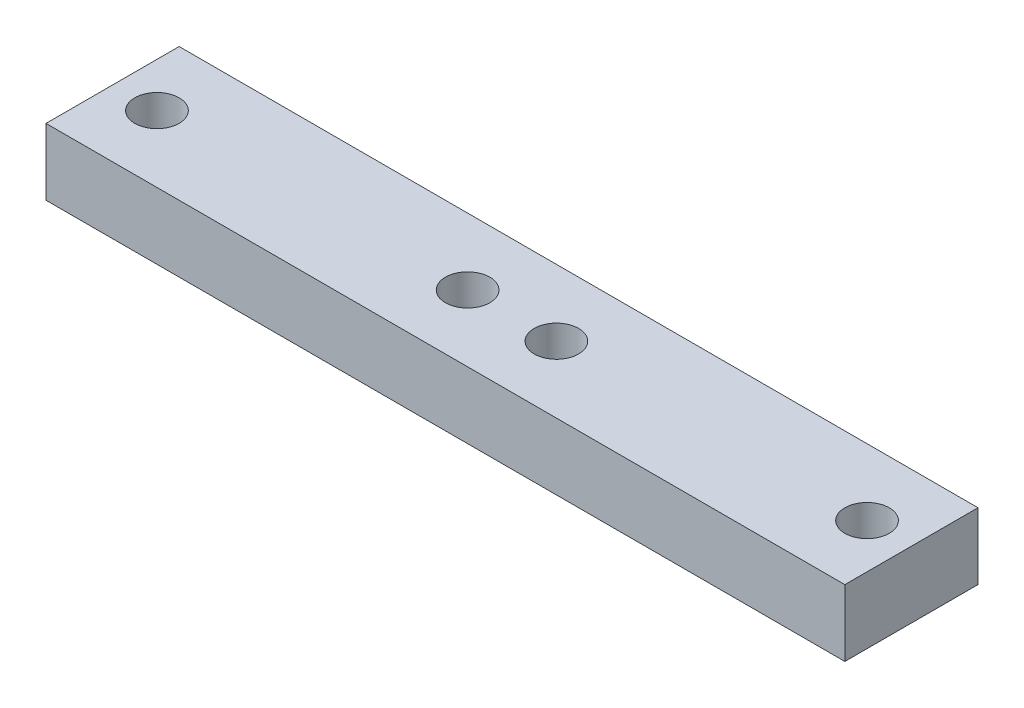
from build123d import *

# Parameters (mm, degrees)
SKETCH1_W           = 72
SKETCH1_H           = 12
SKETCH1_R           = 2
BOSS_EXTRUDE1_DEPTH = 6


with BuildPart() as part:
    # Sketch1 → Boss-Extrude1 (new body)
    with BuildSketch(Plane(origin=(0, 0, 0), x_dir=(1, 0, 0), z_dir=(0, 1, 0))):
        Rectangle(SKETCH1_W, SKETCH1_H)
        with Locations(Location((32, 0, 0), (0, 0, 270))):
            Circle(SKETCH1_R, mode=Mode.SUBTRACT)
        with Locations(Location((4, 0, 0), (0, 0, 270))):
            Circle(SKETCH1_R, mode=Mode.SUBTRACT)
        with Locations(Location((-4, 0, 0), (0, 0, 90))):
            Circle(SKETCH1_R, mode=Mode.SUBTRACT)
        with Locations(Location((-32, 0, 0), (0, 0, 90))):
            Circle(SKETCH1_R, mode=Mode.SUBTRACT)
    extrude(amount=BOSS_EXTRUDE1_DEPTH)


solid = part.part
